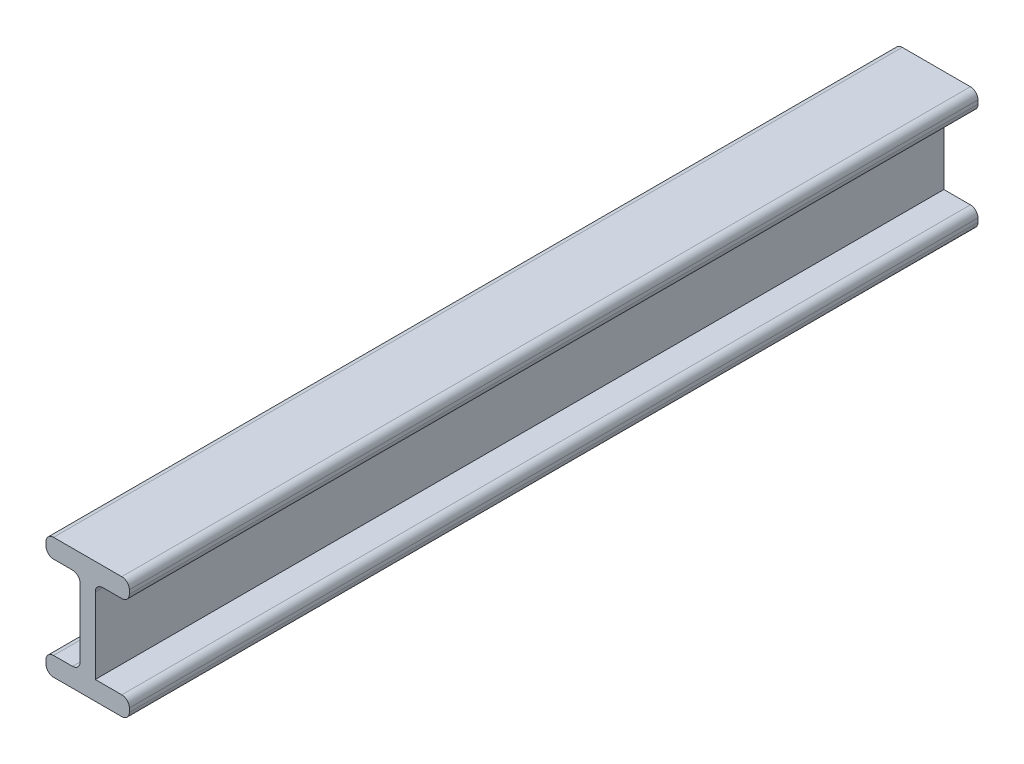
from build123d import *

# Parameters (mm, degrees)
BOSS_EXTRUDE1_DEPTH = 1120


with BuildPart() as part:
    # Sketch1 → Boss-Extrude1 (new body)
    with BuildSketch(Plane.XY):
        with BuildLine():
            Line((-45, 80), (45, 80))
            ThreePointArc((45, 80), (52.071067812, 77.071067812), (55, 70))
            Line((55, 70), (55, 65))
            ThreePointArc((55, 65), (52.071067812, 57.928932188), (45, 55))
            Line((45, 55), (20, 55))
            ThreePointArc((20, 55), (12.928932188, 52.071067812), (10, 45))
            Line((10, 45), (10, -55))
            Line((10, -55), (45, -55))
            ThreePointArc((45, -55), (52.071067812, -57.928932188), (55, -65))
            Line((55, -65), (55, -70))
            ThreePointArc((55, -70), (52.071067812, -77.071067812), (45, -80))
            Line((45, -80), (-45, -80))
            ThreePointArc((-45, -80), (-52.071067812, -77.071067812), (-55, -70))
            Line((-55, -70), (-55, -65))
            ThreePointArc((-55, -65), (-52.071067812, -57.928932188), (-45, -55))
            Line((-45, -55), (-20, -55))
            ThreePointArc((-20, -55), (-12.928932188, -52.071067812), (-10, -45))
            Line((-10, -45), (-10, 45))
            ThreePointArc((-10, 45), (-12.928932188, 52.071067812), (-20, 55))
            Line((-20, 55), (-45, 55))
            ThreePointArc((-45, 55), (-52.071067812, 57.928932188), (-55, 65))
            Line((-55, 65), (-55, 70))
            ThreePointArc((-55, 70), (-52.071067812, 77.071067812), (-45, 80))
        make_face()
    extrude(amount=BOSS_EXTRUDE1_DEPTH)


solid = part.part
